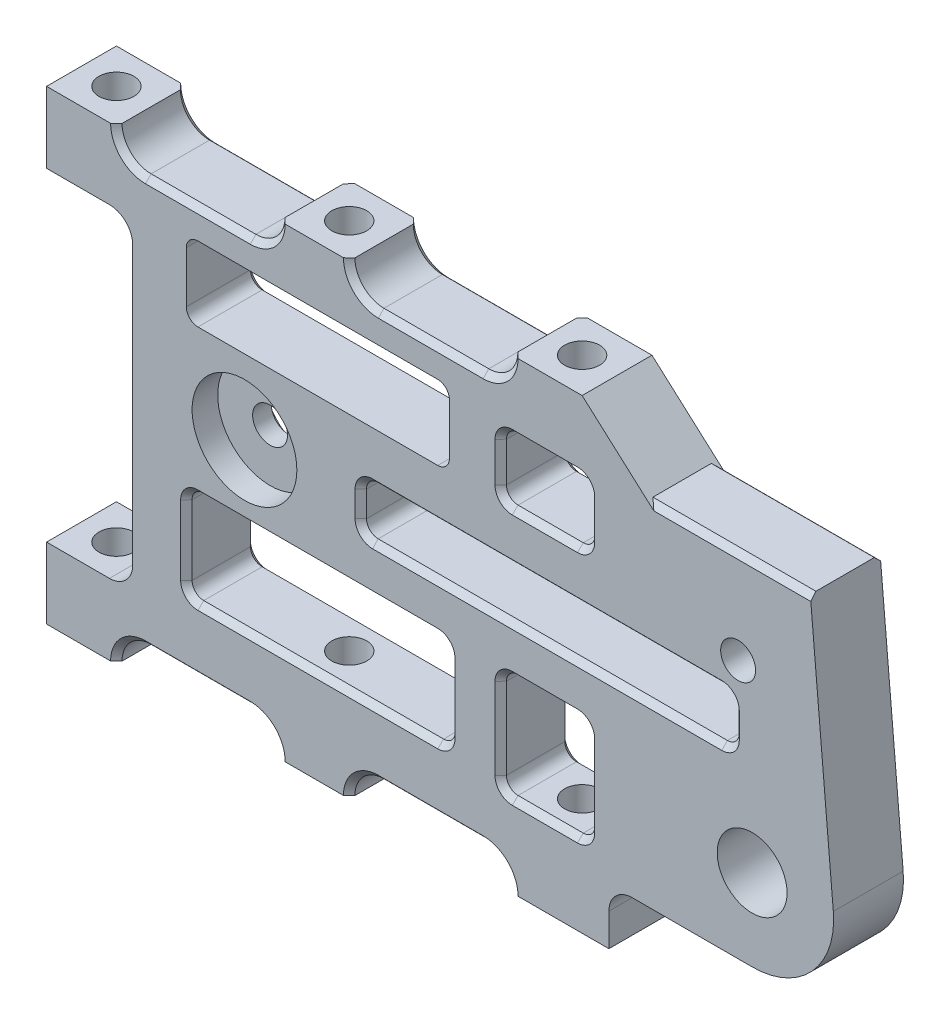
from build123d import *
from OCP.BRepFilletAPI import BRepFilletAPI_MakeChamfer

# Parameters (mm, degrees)
EXTRUDE_1_DEPTH                = 6
CUT_EXTRUDE_1_DEPTH            = 42.498077637
CUT_EXTRUDE_2_DEPTH            = 42.135708795
CUT_EXTRUDE_3_DEPTH            = 42.135708795
SKETCH_5_W                     = 7.4
SKETCH_5_H                     = 27.8
CUT_EXTRUDE_4_DEPTH            = 42.135708795
CUT_EXTRUDE_5_DEPTH            = 42.135708795
CUT_EXTRUDE_6_DEPTH            = 42.135708795
CUT_EXTRUDE_7_DEPTH            = 42.135708795
SKETCH_9_W                     = 7.6
SKETCH_9_H                     = 9
CUT_EXTRUDE_8_DEPTH            = 42.135708795
SKETCH_10_W                    = 22.6
SKETCH_10_H                    = 8
CUT_EXTRUDE_9_DEPTH            = 42.135708795
SKETCH_11_W                    = 22.6
SKETCH_11_H                    = 6.4
CUT_EXTRUDE_10_DEPTH           = 42.135708795
SKETCH_12_W                    = 7.6
SKETCH_12_H                    = 5.4
CUT_EXTRUDE_11_DEPTH           = 42.135708795
SKETCH_13_W                    = 32
SKETCH_13_H                    = 4.2
CUT_EXTRUDE_12_DEPTH           = 42.135708795
HOLE_WIZARD_3_0_3_1_D          = 3
HOLE_WIZARD_6_0_6_1_D          = 6
HOLE_WIZARD_3_0_3_2_D          = 3
HOLE_WIZARD_3_0_3_2_DEPTH      = 7
HOLE_WIZARD_3_0_3_3_D          = 3
HOLE_WIZARD_3_0_3_3_DEPTH      = 8
HOLE_WIZARD_3_0_3_4_D          = 3
HOLE_WIZARD_3_0_3_4_DEPTH      = 5
SKETCH_24_W                    = 1.5
SKETCH_24_H                    = 6
HOLE_WIZARD_3_0_3_6_D          = 3
HOLE_WIZARD_3_0_3_6_DEPTH      = 6.1
HOLE_WIZARD_3_0_3_7_D          = 3
HOLE_WIZARD_M2_5_1_D           = 3
HOLE_WIZARD_M2_5_1_CBORE_D     = 9
HOLE_WIZARD_M2_5_1_CBORE_DEPTH = 2.2
FILLET_1_R                     = 1
FILLET_2_R                     = 2
FILLET_3_R                     = 7
CHAMFER_1_SIZE                 = 0.5
CHAMFER_1_SIZE2                = 0.482844387
CUT_EXTRUDE_START              = -2.2
SKETCH_32_R                    = 4.5
CUT_EXTRUDE_14_DEPTH           = 2.2


with BuildPart() as part:
    # 草图1 → 凸台-拉伸1 (new body)
    with BuildSketch(Plane(origin=(0, 0, 0), x_dir=(-1, 0, 0), z_dir=(0, 0, -1))):
        Polygon((-32.362556682, 20), (-35.862103223, -20), (32.8, -20), (32.8, 20), align=None)
    extrude(amount=-EXTRUDE_1_DEPTH)

    # 草图2 → 切除-拉伸1 (cut, through all)
    with BuildSketch(Plane.XY.offset(6)):
        Polygon((35.442157638, -15.2), (15.5, -15.2), (15.5, -20), (35.862103223, -20), align=None)
    extrude(amount=-CUT_EXTRUDE_1_DEPTH, mode=Mode.SUBTRACT)

    # 草图3 → 切除-拉伸2 (cut, through all)
    with BuildSketch(Plane.XY.offset(6)):
        with BuildLine():
            Line((-6.8, -20), (7.2, -20))
            ThreePointArc((7.2, -20), (6.467766953, -18.232233047), (4.7, -17.5))
            Line((4.7, -17.5), (-4.3, -17.5))
            ThreePointArc((-4.3, -17.5), (-6.067766953, -18.232233047), (-6.8, -20))
        make_face()
    extrude(amount=-CUT_EXTRUDE_2_DEPTH, mode=Mode.SUBTRACT)

    # 草图4 → 切除-拉伸3 (cut, through all)
    with BuildSketch(Plane.XY.offset(6)):
        with BuildLine():
            Line((-26.8, -20), (-12.8, -20))
            ThreePointArc((-12.8, -20), (-13.532233047, -18.232233047), (-15.3, -17.5))
            Line((-15.3, -17.5), (-24.3, -17.5))
            ThreePointArc((-24.3, -17.5), (-26.067766953, -18.232233047), (-26.8, -20))
        make_face()
    extrude(amount=-CUT_EXTRUDE_3_DEPTH, mode=Mode.SUBTRACT)

    # 草图5 → 切除-拉伸4 (cut, through all)
    with BuildSketch(Plane.XY.offset(6)):
        with Locations((-29.1, 0)):
            Rectangle(SKETCH_5_W, SKETCH_5_H)
    extrude(amount=-CUT_EXTRUDE_4_DEPTH, mode=Mode.SUBTRACT)

    # 草图6 → 切除-拉伸5 (cut, through all)
    with BuildSketch(Plane.XY.offset(6)):
        with BuildLine():
            Line((-12.8, 20), (-26.8, 20))
            ThreePointArc((-26.8, 20), (-26.067766953, 18.232233047), (-24.3, 17.5))
            Line((-24.3, 17.5), (-15.3, 17.5))
            ThreePointArc((-15.3, 17.5), (-13.532233047, 18.232233047), (-12.8, 20))
        make_face()
    extrude(amount=-CUT_EXTRUDE_5_DEPTH, mode=Mode.SUBTRACT)

    # 草图7 → 切除-拉伸6 (cut, through all)
    with BuildSketch(Plane.XY.offset(6)):
        with BuildLine():
            Line((7.2, 20), (-6.8, 20))
            ThreePointArc((-6.8, 20), (-6.067766953, 18.232233047), (-4.3, 17.5))
            Line((-4.3, 17.5), (4.7, 17.5))
            ThreePointArc((4.7, 17.5), (6.467766953, 18.232233047), (7.2, 20))
        make_face()
    extrude(amount=-CUT_EXTRUDE_6_DEPTH, mode=Mode.SUBTRACT)

    # 草图8 → 切除-拉伸7 (cut, through all)
    with BuildSketch(Plane.XY.offset(6)):
        Polygon((13.2, 20), (18.8, 15), (32.8, 15), (32.362556682, 20), align=None)
    extrude(amount=-CUT_EXTRUDE_7_DEPTH, mode=Mode.SUBTRACT)

    # 草图9 → 切除-拉伸8 (cut, through all)
    with BuildSketch(Plane(origin=(0, 0, 0), x_dir=(-1, 0, 0), z_dir=(0, 0, -1))):
        with Locations((-10, -8.5)):
            Rectangle(SKETCH_9_W, SKETCH_9_H)
    extrude(amount=-CUT_EXTRUDE_8_DEPTH, mode=Mode.SUBTRACT)

    # 草图10 → 切除-拉伸9 (cut, through all)
    with BuildSketch(Plane(origin=(0, 0, 0), x_dir=(-1, 0, 0), z_dir=(0, 0, -1))):
        with Locations((9.5, -8)):
            Rectangle(SKETCH_10_W, SKETCH_10_H)
    extrude(amount=-CUT_EXTRUDE_9_DEPTH, mode=Mode.SUBTRACT)

    # 草图11 → 切除-拉伸10 (cut, through all)
    with BuildSketch(Plane(origin=(0, 0, 0), x_dir=(-1, 0, 0), z_dir=(0, 0, -1))):
        with Locations((9.5, 11.8)):
            Rectangle(SKETCH_11_W, SKETCH_11_H)
    extrude(amount=-CUT_EXTRUDE_10_DEPTH, mode=Mode.SUBTRACT)

    # 草图12 → 切除-拉伸11 (cut, through all)
    with BuildSketch(Plane(origin=(0, 0, 0), x_dir=(-1, 0, 0), z_dir=(0, 0, -1))):
        with Locations((-10, 11.3)):
            Rectangle(SKETCH_12_W, SKETCH_12_H)
    extrude(amount=-CUT_EXTRUDE_11_DEPTH, mode=Mode.SUBTRACT)

    # 草图13 → 切除-拉伸12 (cut, through all)
    with BuildSketch(Plane.XY.offset(6)):
        with Locations((10.2, 2.2)):
            Rectangle(SKETCH_13_W, SKETCH_13_H)
    extrude(amount=-CUT_EXTRUDE_12_DEPTH, mode=Mode.SUBTRACT)

    # Ø3.0 (3) 直径孔1 (through all)
    with Locations(Plane.XY.offset(6)):
        with Locations((26.6, 7)):
            Hole(HOLE_WIZARD_3_0_3_1_D / 2)

    # Ø6.0 (6) 直径孔1 (through all)
    with Locations(Plane.XY.offset(6)):
        with Locations((27.802998131, -8.2)):
            Hole(HOLE_WIZARD_6_0_6_1_D / 2)

    # Ø3.0 (3) 直径孔2
    with Locations(Plane(origin=(0, -13, 0), x_dir=(1, 0, 0), z_dir=(0, 1, 0))):
        with Locations((10.2, -3)):
            Hole(HOLE_WIZARD_3_0_3_2_D / 2, depth=HOLE_WIZARD_3_0_3_2_DEPTH)

    # Ø3.0 (3) 直径孔3
    with Locations(Plane(origin=(0, -12, 0), x_dir=(1, 0, 0), z_dir=(0, 1, 0))):
        with Locations((-9.8, -3)):
            Hole(HOLE_WIZARD_3_0_3_3_D / 2, depth=HOLE_WIZARD_3_0_3_3_DEPTH)

    # Ø3.0 (3) 直径孔4
    with Locations(Plane(origin=(0, 15, 0), x_dir=(-1, 0, 0), z_dir=(0, -1, 0))):
        with Locations((9.8, -3)):
            Hole(HOLE_WIZARD_3_0_3_4_D / 2, depth=HOLE_WIZARD_3_0_3_4_DEPTH)

    # 草图24 → Ø3.0 (3) 直径孔5 (revolve, cut)
    with BuildSketch(Plane(origin=(10.2, 14, 3), x_dir=(0, 0, -1), z_dir=(1, 0, 0))):
        with Locations((0.75, 3)):
            Rectangle(SKETCH_24_W, SKETCH_24_H)
    revolve(axis=Axis((10.2, 7.65, 3), (0, 1, 0)), mode=Mode.SUBTRACT)

    # Ø3.0 (3) 直径孔6
    with Locations(Plane(origin=(0, -20, 0), x_dir=(-1, 0, 0), z_dir=(0, -1, 0))):
        with Locations((29.8, -3)):
            Hole(HOLE_WIZARD_3_0_3_6_D / 2, depth=HOLE_WIZARD_3_0_3_6_DEPTH)

    # Ø3.0 (3) 直径孔7 (through all)
    with Locations(Plane(origin=(0, 13.9, 0), x_dir=(-1, 0, 0), z_dir=(0, -1, 0))):
        with Locations((29.8, -3)):
            Hole(HOLE_WIZARD_3_0_3_7_D / 2)

    # M2.5 六角头机械螺钉的柱形沉头孔1 (through all)
    with Locations(Plane(origin=(0, 0, 0), x_dir=(-1, 0, 0), z_dir=(0, 0, -1))):
        with Locations((15.8, 2.2)):
            CounterBoreHole(HOLE_WIZARD_M2_5_1_D / 2, HOLE_WIZARD_M2_5_1_CBORE_D / 2, HOLE_WIZARD_M2_5_1_CBORE_DEPTH)

    # 圆角1
    fillet_1_edges = [part.edges().sort_by_distance(p)[0] for p in [
        (13.8, -13, 3),
        (13.8, -4, 3),
        (6.2, -4, 3),
        (6.2, -13, 3),
        (1.8, -12, 3),
        (1.8, -4, 3),
        (-20.8, -4, 3),
        (-20.8, -12, 3),
        (1.8, 15, 3),
        (-20.8, 15, 3),
        (-20.8, 8.6, 3),
        (1.8, 8.6, 3),
        (13.8, 8.6, 3),
        (13.8, 14, 3),
        (6.2, 14, 3),
        (6.2, 8.6, 3),
        (-5.8, 0.1, 3),
        (-5.8, 4.3, 3),
        (26.2, 4.3, 3),
        (26.2, 0.1, 3),
    ]]
    fillet(fillet_1_edges, radius=FILLET_1_R)

    # 圆角2
    fillet_2_edges = [part.edges().sort_by_distance(p)[0] for p in [
        (15.5, -15.2, 3),
        (-25.4, 13.9, 3),
        (-25.4, -13.9, 3),
    ]]
    fillet(fillet_2_edges, radius=FILLET_2_R)

    # 圆角3
    fillet_3_edges = [part.edges().sort_by_distance(p)[0] for p in [
        (35.442157638, -15.2, 3),
    ]]
    fillet(fillet_3_edges, radius=FILLET_3_R)

    # 倒角1: one chamfer whose edges measure the first distance from different faces: ONE call of the kernel's chamfer builder (chamfer() names one face for all edges)
    chamfer_1_edges_1 = [part.edges().sort_by_distance(p)[0] for p in [
        (6.467766953, 18.232233047, 0),
    ]]
    chamfer_1_side_1 = [part.faces().sort_by_distance(p)[0] for p in [
        (6.467766953, 18.232233047, 3),
    ]]
    chamfer_1_edges_2 = [part.edges().sort_by_distance(p)[0] for p in [
        (0.2, 17.5, 0),
    ]]
    chamfer_1_side_2 = [part.faces().sort_by_distance(p)[0] for p in [
        (0.2, 17.5, 3),
    ]]
    chamfer_1_edges_3 = [part.edges().sort_by_distance(p)[0] for p in [
        (-6.067766953, 18.232233047, 0),
    ]]
    chamfer_1_side_3 = [part.faces().sort_by_distance(p)[0] for p in [
        (-6.067766953, 18.232233047, 3),
    ]]
    chamfer_1_edges_4 = [part.edges().sort_by_distance(p)[0] for p in [
        (6.467766953, 18.232233047, 6),
        (-6.067766953, 18.232233047, 6),
        (0.2, 17.5, 6),
        (25.8, 15, 6),
        (10.2, 0.1, 6),
        (-5.8, 2.2, 6),
        (10.2, 4.3, 6),
        (26.2, 2.2, 6),
        (-5.507106781, 0.392893219, 6),
        (25.907106781, 4.007106781, 6),
        (-5.507106781, 4.007106781, 6),
        (25.907106781, 0.392893219, 6),
        (-6.067766953, -18.232233047, 6),
        (6.467766953, -18.232233047, 6),
        (0.2, -17.5, 6),
        (-26.067766953, -18.232233047, 6),
        (-13.532233047, -18.232233047, 6),
        (-19.8, -17.5, 6),
        (-13.532233047, 18.232233047, 6),
        (-26.067766953, 18.232233047, 6),
        (-19.8, 17.5, 6),
    ]]
    chamfer_1_side_4 = [part.faces().sort_by_distance(p)[0] for p in [
        (2.499760825, -0.213186784, 6),
    ]]
    chamfer_1_edges_5 = [part.edges().sort_by_distance(p)[0] for p in [
        (25.8, 15, 0),
    ]]
    chamfer_1_side_5 = [part.faces().sort_by_distance(p)[0] for p in [
        (25.8, 15, 3),
    ]]
    chamfer_1_edges_6 = [part.edges().sort_by_distance(p)[0] for p in [
        (30.802998131, -8.2, 0),
    ]]
    chamfer_1_side_6 = [part.faces().sort_by_distance(p)[0] for p in [
        (30.802998131, -8.2, 3),
    ]]
    chamfer_1_edges_7 = [part.edges().sort_by_distance(p)[0] for p in [
        (-9.5, 15, 0),
        (-20.8, 11.8, 0),
        (13.8, 11.3, 0),
        (10, 14, 0),
        (10, 8.6, 0),
        (-20.8, -8, 0),
        (-9.5, -12, 0),
        (1.8, 11.8, 0),
        (1.8, -8, 0),
        (6.2, 11.3, 0),
        (10, -13, 0),
        (13.8, -8.5, 0),
        (6.2, -8.5, 0),
        (-9.5, 8.6, 0),
        (10, -4, 0),
        (-9.5, -4, 0),
        (-20.507106781, 14.707106781, 0),
        (13.507106781, 13.707106781, 0),
        (13.507106781, 8.892893219, 0),
        (-20.507106781, -11.707106781, 0),
        (1.507106781, 14.707106781, 0),
        (1.507106781, -11.707106781, 0),
        (6.492893219, 8.892893219, 0),
        (13.507106781, -12.707106781, 0),
        (6.492893219, 13.707106781, 0),
        (6.492893219, -12.707106781, 0),
        (1.507106781, 8.892893219, 0),
        (13.507106781, -4.292893219, 0),
        (-20.507106781, 8.892893219, 0),
        (6.492893219, -4.292893219, 0),
        (1.507106781, -4.292893219, 0),
        (-20.507106781, -4.292893219, 0),
    ]]
    chamfer_1_side_7 = [part.faces().sort_by_distance(p)[0] for p in [
        (3.195376415, -0.30491751, 0),
    ]]
    chamfer_1_edges_8 = [part.edges().sort_by_distance(p)[0] for p in [
        (13.8, 11.3, 6),
    ]]
    chamfer_1_side_8 = [part.faces().sort_by_distance(p)[0] for p in [
        (13.8, 11.3, 3),
    ]]
    chamfer_1_edges_9 = [part.edges().sort_by_distance(p)[0] for p in [
        (10, 14, 6),
    ]]
    chamfer_1_side_9 = [part.faces().sort_by_distance(p)[0] for p in [
        (10, 14, 0.082073138),
    ]]
    chamfer_1_edges_10 = [part.edges().sort_by_distance(p)[0] for p in [
        (10, 8.6, 6),
    ]]
    chamfer_1_side_10 = [part.faces().sort_by_distance(p)[0] for p in [
        (10, 8.6, 3),
    ]]
    chamfer_1_edges_11 = [part.edges().sort_by_distance(p)[0] for p in [
        (-20.8, -8, 6),
    ]]
    chamfer_1_side_11 = [part.faces().sort_by_distance(p)[0] for p in [
        (-20.8, -8, 3),
    ]]
    chamfer_1_edges_12 = [part.edges().sort_by_distance(p)[0] for p in [
        (-9.5, -12, 6),
    ]]
    chamfer_1_side_12 = [part.faces().sort_by_distance(p)[0] for p in [
        (-9.5, -12, 0.214560015),
    ]]
    chamfer_1_edges_13 = [part.edges().sort_by_distance(p)[0] for p in [
        (10.2, 0.1, 0),
    ]]
    chamfer_1_side_13 = [part.faces().sort_by_distance(p)[0] for p in [
        (10.2, 0.1, 3),
    ]]
    chamfer_1_edges_14 = [part.edges().sort_by_distance(p)[0] for p in [
        (-5.8, 2.2, 0),
    ]]
    chamfer_1_side_14 = [part.faces().sort_by_distance(p)[0] for p in [
        (-5.8, 2.2, 3),
    ]]
    chamfer_1_edges_15 = [part.edges().sort_by_distance(p)[0] for p in [
        (1.8, -8, 6),
    ]]
    chamfer_1_side_15 = [part.faces().sort_by_distance(p)[0] for p in [
        (1.8, -8, 3),
    ]]
    chamfer_1_edges_16 = [part.edges().sort_by_distance(p)[0] for p in [
        (10.2, 4.3, 0),
    ]]
    chamfer_1_side_16 = [part.faces().sort_by_distance(p)[0] for p in [
        (10.2, 4.3, 3),
    ]]
    chamfer_1_edges_17 = [part.edges().sort_by_distance(p)[0] for p in [
        (26.2, 2.2, 0),
    ]]
    chamfer_1_side_17 = [part.faces().sort_by_distance(p)[0] for p in [
        (26.2, 2.2, 3),
    ]]
    chamfer_1_edges_18 = [part.edges().sort_by_distance(p)[0] for p in [
        (6.2, 11.3, 6),
    ]]
    chamfer_1_side_18 = [part.faces().sort_by_distance(p)[0] for p in [
        (6.2, 11.3, 3),
    ]]
    chamfer_1_edges_19 = [part.edges().sort_by_distance(p)[0] for p in [
        (10, -13, 6),
    ]]
    chamfer_1_side_19 = [part.faces().sort_by_distance(p)[0] for p in [
        (10, -13, 0.082073138),
    ]]
    chamfer_1_edges_20 = [part.edges().sort_by_distance(p)[0] for p in [
        (13.8, -8.5, 6),
    ]]
    chamfer_1_side_20 = [part.faces().sort_by_distance(p)[0] for p in [
        (13.8, -8.5, 3),
    ]]
    chamfer_1_edges_21 = [part.edges().sort_by_distance(p)[0] for p in [
        (6.2, -8.5, 6),
    ]]
    chamfer_1_side_21 = [part.faces().sort_by_distance(p)[0] for p in [
        (6.2, -8.5, 3),
    ]]
    chamfer_1_edges_22 = [part.edges().sort_by_distance(p)[0] for p in [
        (10, -4, 6),
    ]]
    chamfer_1_side_22 = [part.faces().sort_by_distance(p)[0] for p in [
        (10, -4, 3),
    ]]
    chamfer_1_edges_23 = [part.edges().sort_by_distance(p)[0] for p in [
        (-9.5, -4, 6),
    ]]
    chamfer_1_side_23 = [part.faces().sort_by_distance(p)[0] for p in [
        (-9.5, -4, 3),
    ]]
    chamfer_1_edges_24 = [part.edges().sort_by_distance(p)[0] for p in [
        (13.507106781, 13.707106781, 6),
    ]]
    chamfer_1_side_24 = [part.faces().sort_by_distance(p)[0] for p in [
        (13.507106781, 13.707106781, 3),
    ]]
    chamfer_1_edges_25 = [part.edges().sort_by_distance(p)[0] for p in [
        (13.507106781, 8.892893219, 6),
    ]]
    chamfer_1_side_25 = [part.faces().sort_by_distance(p)[0] for p in [
        (13.507106781, 8.892893219, 3),
    ]]
    chamfer_1_edges_26 = [part.edges().sort_by_distance(p)[0] for p in [
        (-20.507106781, -11.707106781, 6),
    ]]
    chamfer_1_side_26 = [part.faces().sort_by_distance(p)[0] for p in [
        (-20.507106781, -11.707106781, 3),
    ]]
    chamfer_1_edges_27 = [part.edges().sort_by_distance(p)[0] for p in [
        (-5.507106781, 0.392893219, 0),
    ]]
    chamfer_1_side_27 = [part.faces().sort_by_distance(p)[0] for p in [
        (-5.507106781, 0.392893219, 3),
    ]]
    chamfer_1_edges_28 = [part.edges().sort_by_distance(p)[0] for p in [
        (1.507106781, -11.707106781, 6),
    ]]
    chamfer_1_side_28 = [part.faces().sort_by_distance(p)[0] for p in [
        (1.507106781, -11.707106781, 3),
    ]]
    chamfer_1_edges_29 = [part.edges().sort_by_distance(p)[0] for p in [
        (25.907106781, 4.007106781, 0),
    ]]
    chamfer_1_side_29 = [part.faces().sort_by_distance(p)[0] for p in [
        (25.907106781, 4.007106781, 3),
    ]]
    chamfer_1_edges_30 = [part.edges().sort_by_distance(p)[0] for p in [
        (6.492893219, 8.892893219, 6),
    ]]
    chamfer_1_side_30 = [part.faces().sort_by_distance(p)[0] for p in [
        (6.492893219, 8.892893219, 3),
    ]]
    chamfer_1_edges_31 = [part.edges().sort_by_distance(p)[0] for p in [
        (13.507106781, -12.707106781, 6),
    ]]
    chamfer_1_side_31 = [part.faces().sort_by_distance(p)[0] for p in [
        (13.507106781, -12.707106781, 3),
    ]]
    chamfer_1_edges_32 = [part.edges().sort_by_distance(p)[0] for p in [
        (6.492893219, 13.707106781, 6),
    ]]
    chamfer_1_side_32 = [part.faces().sort_by_distance(p)[0] for p in [
        (6.492893219, 13.707106781, 3),
    ]]
    chamfer_1_edges_33 = [part.edges().sort_by_distance(p)[0] for p in [
        (6.492893219, -12.707106781, 6),
    ]]
    chamfer_1_side_33 = [part.faces().sort_by_distance(p)[0] for p in [
        (6.492893219, -12.707106781, 3),
    ]]
    chamfer_1_edges_34 = [part.edges().sort_by_distance(p)[0] for p in [
        (13.507106781, -4.292893219, 6),
    ]]
    chamfer_1_side_34 = [part.faces().sort_by_distance(p)[0] for p in [
        (13.507106781, -4.292893219, 3),
    ]]
    chamfer_1_edges_35 = [part.edges().sort_by_distance(p)[0] for p in [
        (6.492893219, -4.292893219, 6),
    ]]
    chamfer_1_side_35 = [part.faces().sort_by_distance(p)[0] for p in [
        (6.492893219, -4.292893219, 3),
    ]]
    chamfer_1_edges_36 = [part.edges().sort_by_distance(p)[0] for p in [
        (-5.507106781, 4.007106781, 0),
    ]]
    chamfer_1_side_36 = [part.faces().sort_by_distance(p)[0] for p in [
        (-5.507106781, 4.007106781, 3),
    ]]
    chamfer_1_edges_37 = [part.edges().sort_by_distance(p)[0] for p in [
        (1.507106781, -4.292893219, 6),
    ]]
    chamfer_1_side_37 = [part.faces().sort_by_distance(p)[0] for p in [
        (1.507106781, -4.292893219, 3),
    ]]
    chamfer_1_edges_38 = [part.edges().sort_by_distance(p)[0] for p in [
        (-6.067766953, -18.232233047, 0),
    ]]
    chamfer_1_side_38 = [part.faces().sort_by_distance(p)[0] for p in [
        (-6.067766953, -18.232233047, 3),
    ]]
    chamfer_1_edges_39 = [part.edges().sort_by_distance(p)[0] for p in [
        (25.907106781, 0.392893219, 0),
    ]]
    chamfer_1_side_39 = [part.faces().sort_by_distance(p)[0] for p in [
        (25.907106781, 0.392893219, 3),
    ]]
    chamfer_1_edges_40 = [part.edges().sort_by_distance(p)[0] for p in [
        (-20.507106781, -4.292893219, 6),
    ]]
    chamfer_1_side_40 = [part.faces().sort_by_distance(p)[0] for p in [
        (-20.507106781, -4.292893219, 3),
    ]]
    chamfer_1_edges_41 = [part.edges().sort_by_distance(p)[0] for p in [
        (0.2, -17.5, 0),
    ]]
    chamfer_1_side_41 = [part.faces().sort_by_distance(p)[0] for p in [
        (0.2, -17.5, 3),
    ]]
    chamfer_1_edges_42 = [part.edges().sort_by_distance(p)[0] for p in [
        (6.467766953, -18.232233047, 0),
    ]]
    chamfer_1_side_42 = [part.faces().sort_by_distance(p)[0] for p in [
        (6.467766953, -18.232233047, 3),
    ]]
    chamfer_1_edges_43 = [part.edges().sort_by_distance(p)[0] for p in [
        (-26.067766953, -18.232233047, 0),
    ]]
    chamfer_1_side_43 = [part.faces().sort_by_distance(p)[0] for p in [
        (-26.067766953, -18.232233047, 3),
    ]]
    chamfer_1_edges_44 = [part.edges().sort_by_distance(p)[0] for p in [
        (-19.8, -17.5, 0),
    ]]
    chamfer_1_side_44 = [part.faces().sort_by_distance(p)[0] for p in [
        (-19.8, -17.5, 3),
    ]]
    chamfer_1_edges_45 = [part.edges().sort_by_distance(p)[0] for p in [
        (-13.532233047, -18.232233047, 0),
    ]]
    chamfer_1_side_45 = [part.faces().sort_by_distance(p)[0] for p in [
        (-13.532233047, -18.232233047, 3),
    ]]
    chamfer_1_edges_46 = [part.edges().sort_by_distance(p)[0] for p in [
        (-13.532233047, 18.232233047, 0),
    ]]
    chamfer_1_side_46 = [part.faces().sort_by_distance(p)[0] for p in [
        (-13.532233047, 18.232233047, 3),
    ]]
    chamfer_1_edges_47 = [part.edges().sort_by_distance(p)[0] for p in [
        (-19.8, 17.5, 0),
    ]]
    chamfer_1_side_47 = [part.faces().sort_by_distance(p)[0] for p in [
        (-19.8, 17.5, 3),
    ]]
    chamfer_1_edges_48 = [part.edges().sort_by_distance(p)[0] for p in [
        (-26.067766953, 18.232233047, 0),
    ]]
    chamfer_1_side_48 = [part.faces().sort_by_distance(p)[0] for p in [
        (-26.067766953, 18.232233047, 3),
    ]]
    chamfer_1 = BRepFilletAPI_MakeChamfer(part.part.solid().wrapped)
    for e in chamfer_1_edges_1:
        chamfer_1.Add(CHAMFER_1_SIZE, CHAMFER_1_SIZE2, e.wrapped, chamfer_1_side_1[0].wrapped)  # the first distance lies on this face
    for e in chamfer_1_edges_2:
        chamfer_1.Add(CHAMFER_1_SIZE, CHAMFER_1_SIZE2, e.wrapped, chamfer_1_side_2[0].wrapped)  # the first distance lies on this face
    for e in chamfer_1_edges_3:
        chamfer_1.Add(CHAMFER_1_SIZE, CHAMFER_1_SIZE2, e.wrapped, chamfer_1_side_3[0].wrapped)  # the first distance lies on this face
    for e in chamfer_1_edges_4:
        chamfer_1.Add(CHAMFER_1_SIZE, CHAMFER_1_SIZE2, e.wrapped, chamfer_1_side_4[0].wrapped)  # the first distance lies on this face
    for e in chamfer_1_edges_5:
        chamfer_1.Add(CHAMFER_1_SIZE, CHAMFER_1_SIZE2, e.wrapped, chamfer_1_side_5[0].wrapped)  # the first distance lies on this face
    for e in chamfer_1_edges_6:
        chamfer_1.Add(CHAMFER_1_SIZE, CHAMFER_1_SIZE2, e.wrapped, chamfer_1_side_6[0].wrapped)  # the first distance lies on this face
    for e in chamfer_1_edges_7:
        chamfer_1.Add(CHAMFER_1_SIZE, CHAMFER_1_SIZE2, e.wrapped, chamfer_1_side_7[0].wrapped)  # the first distance lies on this face
    for e in chamfer_1_edges_8:
        chamfer_1.Add(CHAMFER_1_SIZE, CHAMFER_1_SIZE2, e.wrapped, chamfer_1_side_8[0].wrapped)  # the first distance lies on this face
    for e in chamfer_1_edges_9:
        chamfer_1.Add(CHAMFER_1_SIZE, CHAMFER_1_SIZE2, e.wrapped, chamfer_1_side_9[0].wrapped)  # the first distance lies on this face
    for e in chamfer_1_edges_10:
        chamfer_1.Add(CHAMFER_1_SIZE, CHAMFER_1_SIZE2, e.wrapped, chamfer_1_side_10[0].wrapped)  # the first distance lies on this face
    for e in chamfer_1_edges_11:
        chamfer_1.Add(CHAMFER_1_SIZE, CHAMFER_1_SIZE2, e.wrapped, chamfer_1_side_11[0].wrapped)  # the first distance lies on this face
    for e in chamfer_1_edges_12:
        chamfer_1.Add(CHAMFER_1_SIZE, CHAMFER_1_SIZE2, e.wrapped, chamfer_1_side_12[0].wrapped)  # the first distance lies on this face
    for e in chamfer_1_edges_13:
        chamfer_1.Add(CHAMFER_1_SIZE, CHAMFER_1_SIZE2, e.wrapped, chamfer_1_side_13[0].wrapped)  # the first distance lies on this face
    for e in chamfer_1_edges_14:
        chamfer_1.Add(CHAMFER_1_SIZE, CHAMFER_1_SIZE2, e.wrapped, chamfer_1_side_14[0].wrapped)  # the first distance lies on this face
    for e in chamfer_1_edges_15:
        chamfer_1.Add(CHAMFER_1_SIZE, CHAMFER_1_SIZE2, e.wrapped, chamfer_1_side_15[0].wrapped)  # the first distance lies on this face
    for e in chamfer_1_edges_16:
        chamfer_1.Add(CHAMFER_1_SIZE, CHAMFER_1_SIZE2, e.wrapped, chamfer_1_side_16[0].wrapped)  # the first distance lies on this face
    for e in chamfer_1_edges_17:
        chamfer_1.Add(CHAMFER_1_SIZE, CHAMFER_1_SIZE2, e.wrapped, chamfer_1_side_17[0].wrapped)  # the first distance lies on this face
    for e in chamfer_1_edges_18:
        chamfer_1.Add(CHAMFER_1_SIZE, CHAMFER_1_SIZE2, e.wrapped, chamfer_1_side_18[0].wrapped)  # the first distance lies on this face
    for e in chamfer_1_edges_19:
        chamfer_1.Add(CHAMFER_1_SIZE, CHAMFER_1_SIZE2, e.wrapped, chamfer_1_side_19[0].wrapped)  # the first distance lies on this face
    for e in chamfer_1_edges_20:
        chamfer_1.Add(CHAMFER_1_SIZE, CHAMFER_1_SIZE2, e.wrapped, chamfer_1_side_20[0].wrapped)  # the first distance lies on this face
    for e in chamfer_1_edges_21:
        chamfer_1.Add(CHAMFER_1_SIZE, CHAMFER_1_SIZE2, e.wrapped, chamfer_1_side_21[0].wrapped)  # the first distance lies on this face
    for e in chamfer_1_edges_22:
        chamfer_1.Add(CHAMFER_1_SIZE, CHAMFER_1_SIZE2, e.wrapped, chamfer_1_side_22[0].wrapped)  # the first distance lies on this face
    for e in chamfer_1_edges_23:
        chamfer_1.Add(CHAMFER_1_SIZE, CHAMFER_1_SIZE2, e.wrapped, chamfer_1_side_23[0].wrapped)  # the first distance lies on this face
    for e in chamfer_1_edges_24:
        chamfer_1.Add(CHAMFER_1_SIZE, CHAMFER_1_SIZE2, e.wrapped, chamfer_1_side_24[0].wrapped)  # the first distance lies on this face
    for e in chamfer_1_edges_25:
        chamfer_1.Add(CHAMFER_1_SIZE, CHAMFER_1_SIZE2, e.wrapped, chamfer_1_side_25[0].wrapped)  # the first distance lies on this face
    for e in chamfer_1_edges_26:
        chamfer_1.Add(CHAMFER_1_SIZE, CHAMFER_1_SIZE2, e.wrapped, chamfer_1_side_26[0].wrapped)  # the first distance lies on this face
    for e in chamfer_1_edges_27:
        chamfer_1.Add(CHAMFER_1_SIZE, CHAMFER_1_SIZE2, e.wrapped, chamfer_1_side_27[0].wrapped)  # the first distance lies on this face
    for e in chamfer_1_edges_28:
        chamfer_1.Add(CHAMFER_1_SIZE, CHAMFER_1_SIZE2, e.wrapped, chamfer_1_side_28[0].wrapped)  # the first distance lies on this face
    for e in chamfer_1_edges_29:
        chamfer_1.Add(CHAMFER_1_SIZE, CHAMFER_1_SIZE2, e.wrapped, chamfer_1_side_29[0].wrapped)  # the first distance lies on this face
    for e in chamfer_1_edges_30:
        chamfer_1.Add(CHAMFER_1_SIZE, CHAMFER_1_SIZE2, e.wrapped, chamfer_1_side_30[0].wrapped)  # the first distance lies on this face
    for e in chamfer_1_edges_31:
        chamfer_1.Add(CHAMFER_1_SIZE, CHAMFER_1_SIZE2, e.wrapped, chamfer_1_side_31[0].wrapped)  # the first distance lies on this face
    for e in chamfer_1_edges_32:
        chamfer_1.Add(CHAMFER_1_SIZE, CHAMFER_1_SIZE2, e.wrapped, chamfer_1_side_32[0].wrapped)  # the first distance lies on this face
    for e in chamfer_1_edges_33:
        chamfer_1.Add(CHAMFER_1_SIZE, CHAMFER_1_SIZE2, e.wrapped, chamfer_1_side_33[0].wrapped)  # the first distance lies on this face
    for e in chamfer_1_edges_34:
        chamfer_1.Add(CHAMFER_1_SIZE, CHAMFER_1_SIZE2, e.wrapped, chamfer_1_side_34[0].wrapped)  # the first distance lies on this face
    for e in chamfer_1_edges_35:
        chamfer_1.Add(CHAMFER_1_SIZE, CHAMFER_1_SIZE2, e.wrapped, chamfer_1_side_35[0].wrapped)  # the first distance lies on this face
    for e in chamfer_1_edges_36:
        chamfer_1.Add(CHAMFER_1_SIZE, CHAMFER_1_SIZE2, e.wrapped, chamfer_1_side_36[0].wrapped)  # the first distance lies on this face
    for e in chamfer_1_edges_37:
        chamfer_1.Add(CHAMFER_1_SIZE, CHAMFER_1_SIZE2, e.wrapped, chamfer_1_side_37[0].wrapped)  # the first distance lies on this face
    for e in chamfer_1_edges_38:
        chamfer_1.Add(CHAMFER_1_SIZE, CHAMFER_1_SIZE2, e.wrapped, chamfer_1_side_38[0].wrapped)  # the first distance lies on this face
    for e in chamfer_1_edges_39:
        chamfer_1.Add(CHAMFER_1_SIZE, CHAMFER_1_SIZE2, e.wrapped, chamfer_1_side_39[0].wrapped)  # the first distance lies on this face
    for e in chamfer_1_edges_40:
        chamfer_1.Add(CHAMFER_1_SIZE, CHAMFER_1_SIZE2, e.wrapped, chamfer_1_side_40[0].wrapped)  # the first distance lies on this face
    for e in chamfer_1_edges_41:
        chamfer_1.Add(CHAMFER_1_SIZE, CHAMFER_1_SIZE2, e.wrapped, chamfer_1_side_41[0].wrapped)  # the first distance lies on this face
    for e in chamfer_1_edges_42:
        chamfer_1.Add(CHAMFER_1_SIZE, CHAMFER_1_SIZE2, e.wrapped, chamfer_1_side_42[0].wrapped)  # the first distance lies on this face
    for e in chamfer_1_edges_43:
        chamfer_1.Add(CHAMFER_1_SIZE, CHAMFER_1_SIZE2, e.wrapped, chamfer_1_side_43[0].wrapped)  # the first distance lies on this face
    for e in chamfer_1_edges_44:
        chamfer_1.Add(CHAMFER_1_SIZE, CHAMFER_1_SIZE2, e.wrapped, chamfer_1_side_44[0].wrapped)  # the first distance lies on this face
    for e in chamfer_1_edges_45:
        chamfer_1.Add(CHAMFER_1_SIZE, CHAMFER_1_SIZE2, e.wrapped, chamfer_1_side_45[0].wrapped)  # the first distance lies on this face
    for e in chamfer_1_edges_46:
        chamfer_1.Add(CHAMFER_1_SIZE, CHAMFER_1_SIZE2, e.wrapped, chamfer_1_side_46[0].wrapped)  # the first distance lies on this face
    for e in chamfer_1_edges_47:
        chamfer_1.Add(CHAMFER_1_SIZE, CHAMFER_1_SIZE2, e.wrapped, chamfer_1_side_47[0].wrapped)  # the first distance lies on this face
    for e in chamfer_1_edges_48:
        chamfer_1.Add(CHAMFER_1_SIZE, CHAMFER_1_SIZE2, e.wrapped, chamfer_1_side_48[0].wrapped)  # the first distance lies on this face
    add(Compound.cast(chamfer_1.Shape()), mode=Mode.REPLACE)

    # 草图32 → 切除-拉伸14 (cut)
    with BuildSketch(Plane.XY.offset(6).offset(CUT_EXTRUDE_START)):
        with Locations(Location((-15.8, 2.2, 0), (0, 0, 180))):
            Circle(SKETCH_32_R)
    extrude(amount=CUT_EXTRUDE_14_DEPTH, mode=Mode.SUBTRACT)


solid = part.part
